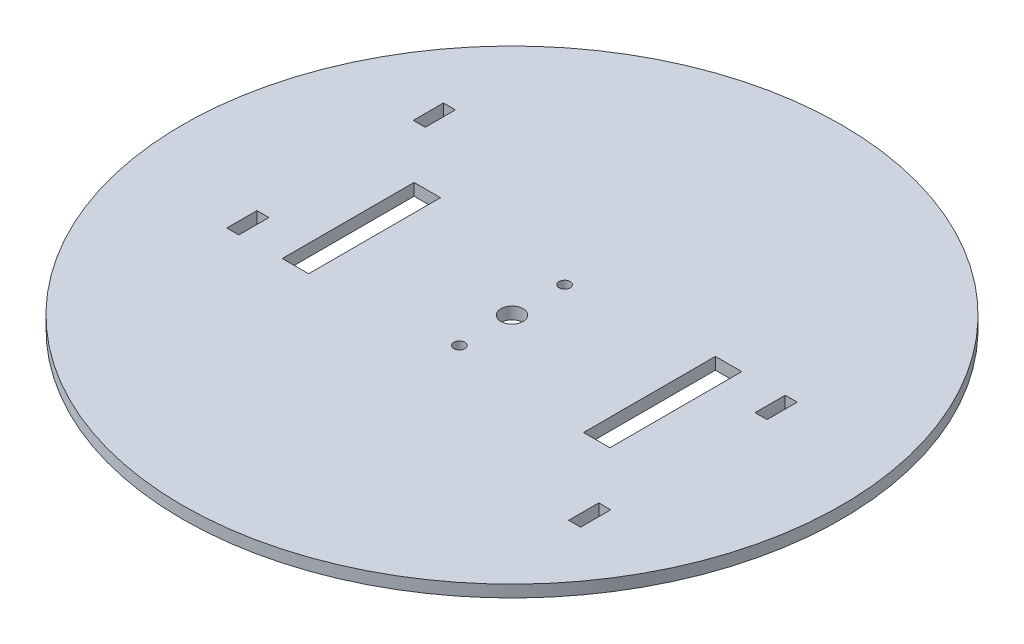
from build123d import *

# Parameters (mm, degrees)
SKETCH1_R           = 87.5
BOSS_EXTRUDE1_DEPTH = 3.18
SKETCH2_W           = 7
SKETCH2_H           = 35
CUT_EXTRUDE1_DEPTH  = 3.18
SKETCH7_R           = 2.95
CUT_EXTRUDE5_DEPTH  = 10
SKETCH8_R           = 1.47
CUT_EXTRUDE6_DEPTH  = 124.78454023
SKETCH3_W           = 3.18
SKETCH3_H           = 8
CUT_EXTRUDE13_DEPTH = 124.78454023


with BuildPart() as part:
    # Sketch1 → Boss-Extrude1 (new body)
    with BuildSketch(Plane(origin=(0, 0, 0), x_dir=(1, 0, 0), z_dir=(0, 1, 0))):
        with Locations(Location((0, 0, 0), (0, 0, 90))):
            Circle(SKETCH1_R)
    extrude(amount=BOSS_EXTRUDE1_DEPTH)

    # Sketch2 → Cut-Extrude1 (cut)
    with BuildSketch(Plane(origin=(0, 3.18, 0), x_dir=(1, 0, 0), z_dir=(0, 1, 0))):
        with Locations((-40, 0)):
            Rectangle(SKETCH2_W, SKETCH2_H)
        with Locations((40, 0)):
            Rectangle(SKETCH2_W, SKETCH2_H)
    extrude(amount=-CUT_EXTRUDE1_DEPTH, mode=Mode.SUBTRACT)

    # Sketch7 → Cut-Extrude5 (cut)
    with BuildSketch(Plane.XZ):
        with Locations(Location((0, 0, 0), (0, 0, 270))):
            Circle(SKETCH7_R)
    extrude(amount=-CUT_EXTRUDE5_DEPTH, mode=Mode.SUBTRACT)

    # Sketch8 → Cut-Extrude6 (cut, through all)
    with BuildSketch(Plane(origin=(0, 3.18, 0), x_dir=(1, 0, 0), z_dir=(0, 1, 0))):
        with Locations(Location((0, 13.975, 0), (0, 0, 270))):
            Circle(SKETCH8_R)
        with Locations(Location((0, -13.975, 0), (0, 0, 270))):
            Circle(SKETCH8_R)
    extrude(amount=-CUT_EXTRUDE6_DEPTH, mode=Mode.SUBTRACT)

    # Sketch3 → Cut-Extrude13 (cut, through all)
    with BuildSketch(Plane.XZ):
        with Locations((56.29, -13.84)):
            Rectangle(SKETCH3_W, SKETCH3_H)
        with Locations((56.29, 35.66)):
            Rectangle(SKETCH3_W, SKETCH3_H)
        with Locations((-56.29, 13.84)):
            Rectangle(SKETCH3_W, SKETCH3_H)
        with Locations((-56.29, -35.66)):
            Rectangle(SKETCH3_W, SKETCH3_H)
    extrude(amount=-CUT_EXTRUDE13_DEPTH, mode=Mode.SUBTRACT)


solid = part.part
